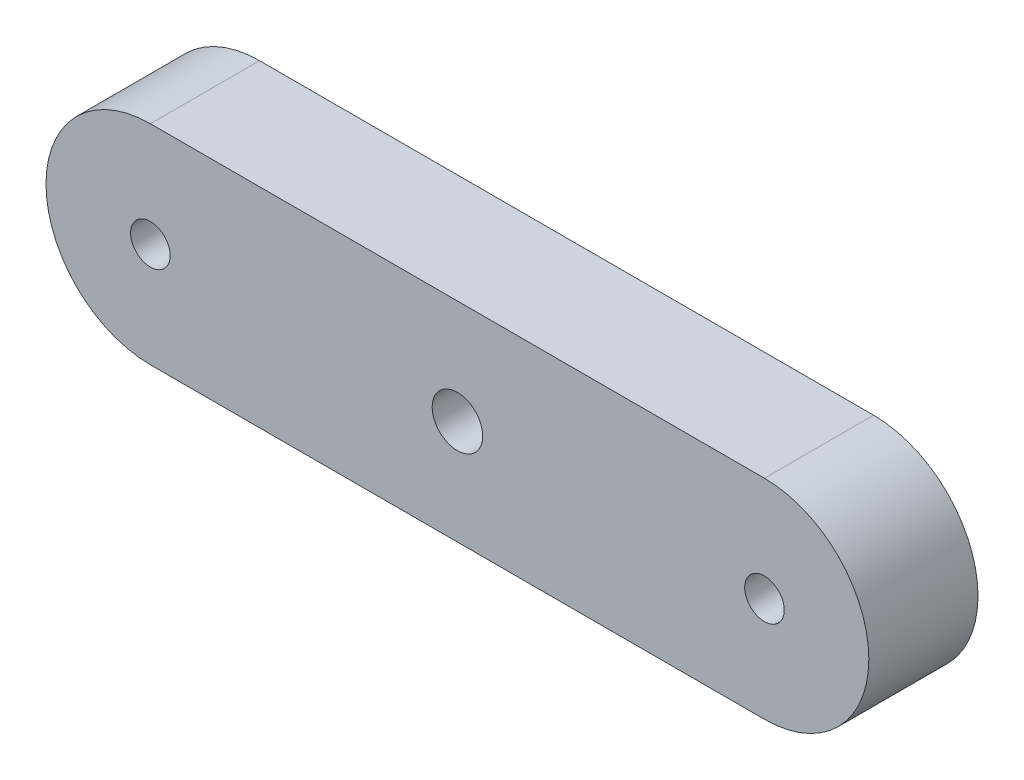
from build123d import *

# Parameters (mm, degrees)
SKETCH_1_R      = 1.45
SKETCH_1_R_2    = 5.15
EXTRUDE_1_DEPTH = 8
SKETCH_2_R      = 5.305373799
SKETCH_2_R_2    = 1.85
EXTRUDE_2_DEPTH = 8


with BuildPart() as part:
    # Эскиз1 → Бобышка-Вытянуть1 (new body)
    with BuildSketch(Plane.XY):
        with BuildLine():
            Line((0, 7.65), (45, 7.65))
            ThreePointArc((45, 7.65), (52.65, 0), (45, -7.65))
            Line((45, -7.65), (0, -7.65))
            ThreePointArc((0, -7.65), (-7.65, 0), (0, 7.65))
        make_face()
        Circle(SKETCH_1_R, mode=Mode.SUBTRACT)
        with Locations((45, 0)):
            Circle(SKETCH_1_R, mode=Mode.SUBTRACT)
        with Locations((22.5, 0)):
            Circle(SKETCH_1_R_2, mode=Mode.SUBTRACT)
    extrude(amount=EXTRUDE_1_DEPTH)

    # Эскиз2 → Бобышка-Вытянуть2 (add)
    with BuildSketch(Plane(origin=(0, 0, 0), x_dir=(-1, 0, 0), z_dir=(0, 0, -1))):
        with Locations((-22.5, 0)):
            Circle(SKETCH_2_R)
        with Locations((-22.5, 0)):
            Circle(SKETCH_2_R_2, mode=Mode.SUBTRACT)
    extrude(amount=-EXTRUDE_2_DEPTH)


solid = part.part
